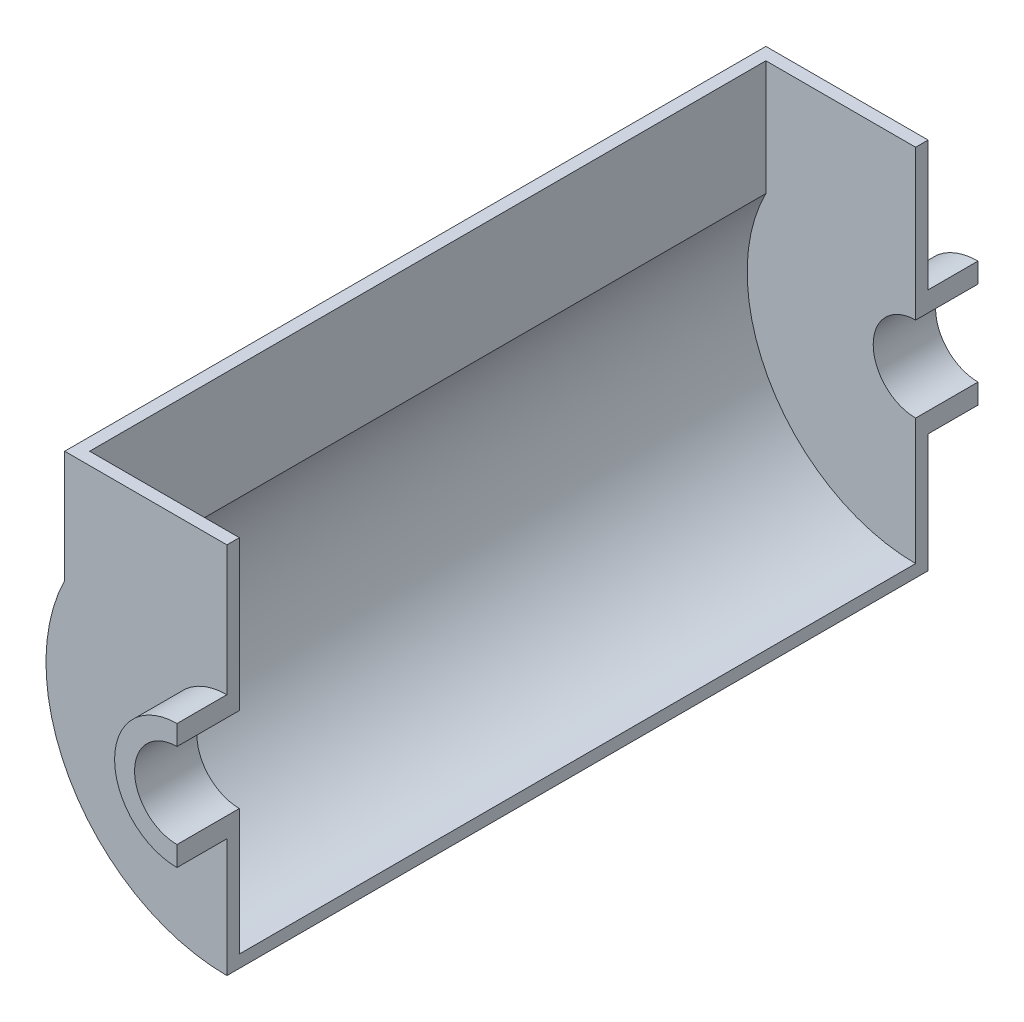
from build123d import *

# Parameters (mm, degrees)
BOSS_EXTRUDE1_DEPTH      = 20
BOSS_EXTRUDE1_DEPTH_BACK = 5
BOSS_EXTRUDE2_START      = -5
BOSS_EXTRUDE2_DEPTH      = 5
BOSS_EXTRUDE3_START      = 271
BOSS_EXTRUDE3_DEPTH      = 271


with BuildPart() as part:
    # Sketch2 → Boss-Extrude1 (new, two sides: drawn at the far end of the back side and taken through both)
    with BuildSketch(Plane.XY.offset(-BOSS_EXTRUDE1_DEPTH_BACK)):
        with BuildLine():
            Line((0, 25), (0, 17))
            ThreePointArc((0, 17), (-17, 0), (0, -17))
            Line((0, -17), (0, -25))
            ThreePointArc((0, -25), (-25, 0), (0, 25))
        make_face()
    extrude(amount=BOSS_EXTRUDE1_DEPTH + BOSS_EXTRUDE1_DEPTH_BACK)

    # Sketch3 → Boss-Extrude2 (add)
    with BuildSketch(Plane.XY.offset(BOSS_EXTRUDE2_START)):
        with BuildLine():
            Line((0, 25), (0, 77))
            Line((0, 77), (-65, 77))
            Line((-65, 77), (-65, 32.113081447))
            ThreePointArc((-65, 32.113081447), (-61.581037686, -38.262590053), (0, -72.5))
            Line((0, -72.5), (0, -25))
            ThreePointArc((0, -25), (-25, 0), (0, 25))
        make_face()
    extrude(amount=BOSS_EXTRUDE2_DEPTH)


with BuildPart() as body_2:
    # Mirror3: mirrored copy
    add(part.part.mirror(Plane.XY.offset(-140.5)))


with BuildPart() as part_1:
    add(part.part)

    add(body_2.part)  # Boss-Extrude3 merges body 2
    # Sketch4 → Boss-Extrude3 (add)
    with BuildSketch(Plane(origin=(0, 0, -5), x_dir=(-1, 0, 0), z_dir=(0, 0, -1)).offset(BOSS_EXTRUDE3_START)):
        with BuildLine():
            Line((65, 77), (65, 32.113081447))
            ThreePointArc((65, 32.113081447), (61.581037686, -38.262590053), (0, -72.5))
            Line((0, -72.5), (0, -67.5))
            ThreePointArc((0, -67.5), (57.634938288, -35.134938288), (60, 30.923292192))
            Line((60, 30.923292192), (60, 77))
            Line((60, 77), (65, 77))
        make_face()
    extrude(amount=-BOSS_EXTRUDE3_DEPTH)


solid = part_1.part
